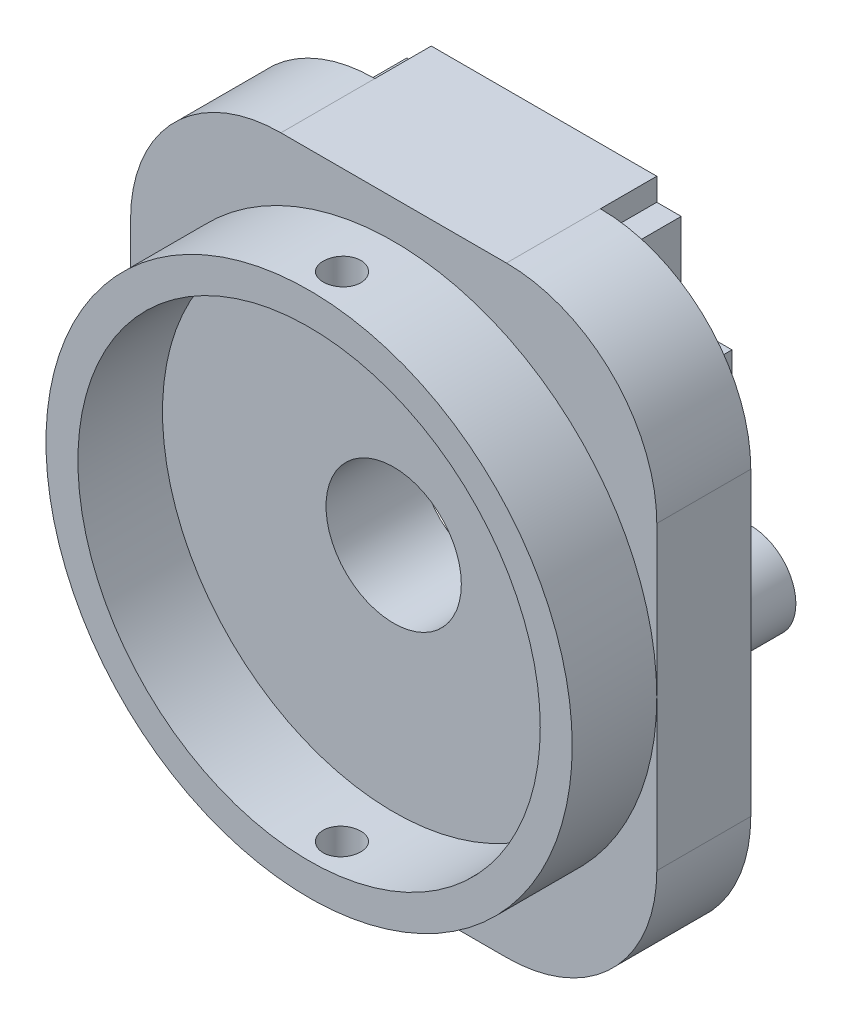
from build123d import *

# Parameters (mm, degrees)
EXTRUDE_1_DEPTH         = 5
SKETCH_2_R              = 14
SKETCH_2_R_2            = 12.3
EXTRUDE_2_DEPTH         = 4.5
SKETCH_3_W              = 18
SKETCH_3_H              = 18
EXTRUDE_3_DEPTH         = 3
SKETCH_4_R              = 3.6
CUT_EXTRUDE_2_DEPTH     = 24.286262044
HOLE_WIZARD_M2_1_D      = 2.4
HOLE_WIZARD_M2_1_DEPTH  = 3
HOLE_WIZARD_M2_1_TIP    = 0.721032743
CUT_EXTRUDE1_DEPTH      = 24.286262044
CUT_EXTRUDE1_DEPTH_BACK = 24.286262044
SKETCH1_R               = 1


with BuildPart() as part:
    # 스케치1 → 보스-돌출1 (new body)
    with BuildSketch(Plane.XY):
        with BuildLine():
            Line((-6, 16), (6, 16))
            ThreePointArc((6, 16), (11.656854249, 13.656854249), (14, 8))
            Line((14, 8), (14, -8))
            ThreePointArc((14, -8), (11.656854249, -13.656854249), (6, -16))
            Line((6, -16), (-6, -16))
            ThreePointArc((-6, -16), (-11.656854249, -13.656854249), (-14, -8))
            Line((-14, -8), (-14, 8))
            ThreePointArc((-14, 8), (-11.656854249, 13.656854249), (-6, 16))
        make_face()
    extrude(amount=EXTRUDE_1_DEPTH)

    # 스케치2 → 보스-돌출2 (add)
    with BuildSketch(Plane.XY.offset(5)):
        Circle(SKETCH_2_R)
        Circle(SKETCH_2_R_2, mode=Mode.SUBTRACT)
    extrude(amount=EXTRUDE_2_DEPTH)

    # 스케치3 → 보스-돌출3 (add)
    with BuildSketch(Plane(origin=(0, 0, 0), x_dir=(-1, 0, 0), z_dir=(0, 0, -1))):
        with BuildLine():
            Line((-10, 10), (-7.3, 10))
            Line((-7.3, 10), (-7.3, 14.8))
            Line((-7.3, 14.8), (-6, 14.8))
            Line((-6, 14.8), (-6, 16))
            Line((-6, 16), (6, 16))
            Line((6, 16), (6, 14.8))
            Line((6, 14.8), (7.3, 14.8))
            Line((7.3, 14.8), (7.3, 10))
            Line((7.3, 10), (10, 10))
            Line((10, 10), (10, 2.4))
            Line((10, 2.4), (11, 2.4))
            ThreePointArc((11, 2.4), (13.4, 0), (11, -2.4))
            Line((11, -2.4), (10, -2.4))
            Line((10, -2.4), (10, -10))
            Line((10, -10), (-10, -10))
            Line((-10, -10), (-10, -2.4))
            Line((-10, -2.4), (-11, -2.4))
            ThreePointArc((-11, -2.4), (-13.4, 0), (-11, 2.4))
            Line((-11, 2.4), (-10, 2.4))
            Line((-10, 2.4), (-10, 10))
        make_face()
        Rectangle(SKETCH_3_W, SKETCH_3_H, mode=Mode.SUBTRACT)
    extrude(amount=EXTRUDE_3_DEPTH)

    # 스케치4 → 컷-돌출2 (cut, through all)
    with BuildSketch(Plane.XY):
        Circle(SKETCH_4_R)
    extrude(amount=CUT_EXTRUDE_2_DEPTH, mode=Mode.SUBTRACT)

    # M2 여유 구멍1
    with Locations(Plane(origin=(-11, 0, -3), x_dir=(-1, 0, 0), z_dir=(0, 0, -1))):
        with Locations((0, 0), (-22, 0)):
            Hole(HOLE_WIZARD_M2_1_D / 2, depth=HOLE_WIZARD_M2_1_DEPTH)
            with Locations((0, 0, -(HOLE_WIZARD_M2_1_DEPTH + HOLE_WIZARD_M2_1_TIP / 2))):  # 118° drill point
                Cone(0, HOLE_WIZARD_M2_1_D / 2, HOLE_WIZARD_M2_1_TIP, mode=Mode.SUBTRACT)

    # Sketch1 → Cut-Extrude1 (cut, two sides: drawn at the far end of the back side and taken through both)
    with BuildSketch(Plane(origin=(0, 0, 0), x_dir=(1, 0, 0), z_dir=(0, 1, 0)).offset(-CUT_EXTRUDE1_DEPTH_BACK)):
        with Locations(Location((0, -7.75, 0), (0, 0, 270))):
            Circle(SKETCH1_R)
    extrude(amount=CUT_EXTRUDE1_DEPTH + CUT_EXTRUDE1_DEPTH_BACK, mode=Mode.SUBTRACT)


solid = part.part
